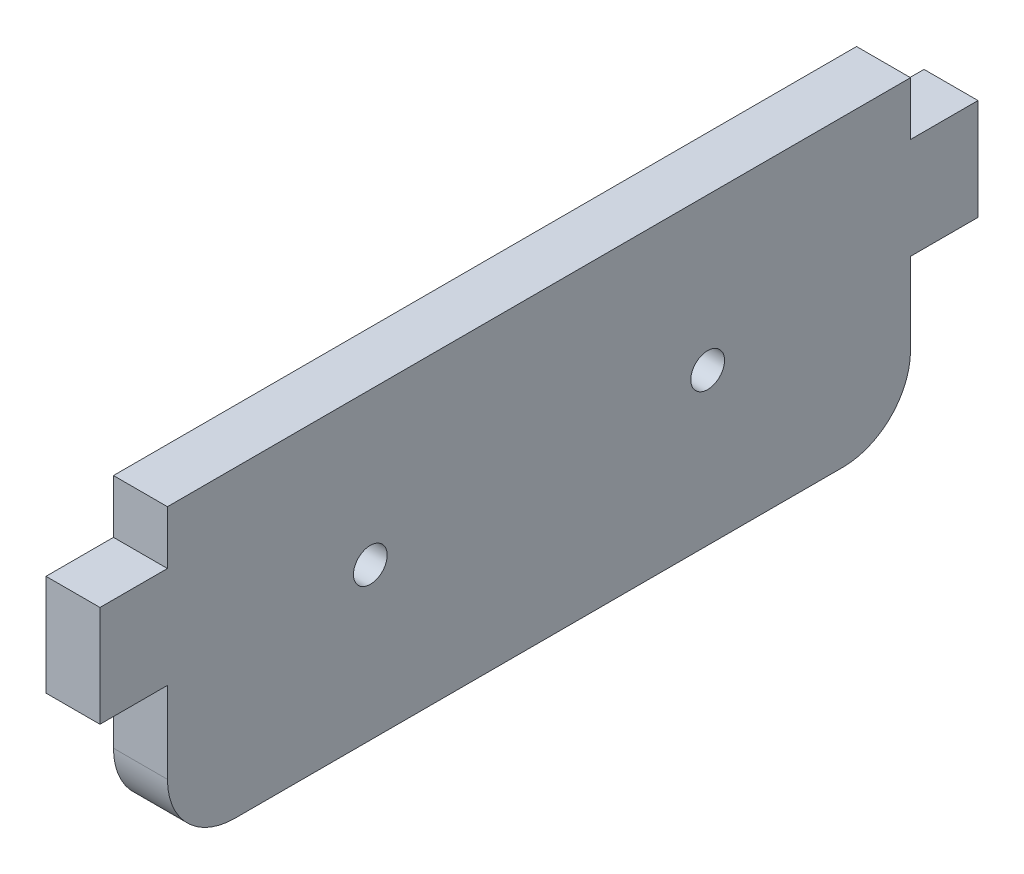
from build123d import *

# Parameters (mm, degrees)
SKETCH1_W           = 8
SKETCH1_H           = 15
BOSS_EXTRUDE1_DEPTH = 10
BOSS_EXTRUDE2_DEPTH = 110.14
FILLET1_R           = 10
SKETCH4_R           = 2.5
CUT_EXTRUDE1_DEPTH  = 10


with BuildPart() as part:
    # Sketch1 → Boss-Extrude1 (new body)
    with BuildSketch(Plane.XY):
        with Locations((-55, -78)):
            Rectangle(SKETCH1_W, SKETCH1_H)
    boss_extrude1 = extrude(amount=-BOSS_EXTRUDE1_DEPTH)

    # Sketch2 → Boss-Extrude2 (add)
    with BuildSketch(Plane(origin=(0, 0, -10), x_dir=(-1, 0, 0), z_dir=(0, 0, -1))):
        Polygon((51, -62.565581077), (59, -62.565581077), (59, -92.565581077), (59, -107.565581077), (51, -107.565581077), (51, -92.565581077), align=None)
    extrude(amount=BOSS_EXTRUDE2_DEPTH)

    # Fillet1
    fillet1_edges = [part.edges().sort_by_distance(p)[0] for p in [
        (-55, -107.565581077, -120.14),
        (-55, -107.565581077, -10),
    ]]
    fillet(fillet1_edges, radius=FILLET1_R)

    # Mirror1: Boss-Extrude1 across plane
    add(boss_extrude1.mirror(Plane.XY.offset(-65.07)))

    # Sketch4 → Cut-Extrude1 (cut)
    with BuildSketch(Plane(origin=(-51, 0, 0), x_dir=(0, 0, -1), z_dir=(1, 0, 0))):
        with Locations((40.07, -85.065581077)):
            Circle(SKETCH4_R)
        with Locations(Location((90.07, -85.065581077, 0), (0, 0, 180))):
            Circle(SKETCH4_R)
    extrude(amount=-CUT_EXTRUDE1_DEPTH, mode=Mode.SUBTRACT)


solid = part.part
